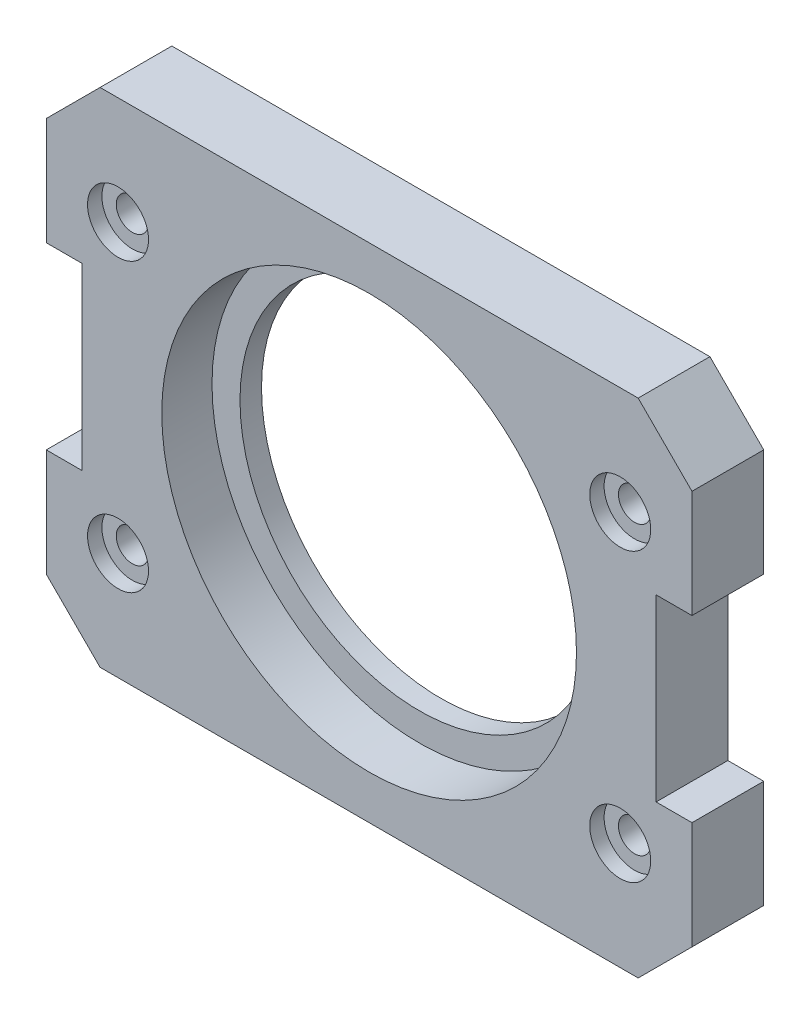
from build123d import *

# Parameters (mm, degrees)
CROQUIS1_W              = 90
CROQUIS1_H              = 70
CROQUIS1_R              = 28.9
CROQUIS1_R_2            = 2.25
SALIENTE_EXTRUIR1_DEPTH = 5
CROQUIS2_R              = 28.9
CROQUIS2_R_2            = 25
SALIENTE_EXTRUIR2_DEPTH = 3
CROQUIS3_R              = 4.25
CORTAR_EXTRUIR1_DEPTH   = 2
CROQUIS4_W              = 10
CROQUIS4_H              = 25
CORTAR_EXTRUIR2_DEPTH   = 58.879184514
CHAFL_N2_SIZE           = 7.5


with BuildPart() as part:
    # Croquis1 → Saliente-Extruir1 (new, symmetric)
    with BuildSketch(Plane.XY):
        Rectangle(CROQUIS1_W, CROQUIS1_H)
        Circle(CROQUIS1_R, mode=Mode.SUBTRACT)
        with Locations((35, 20)):
            Circle(CROQUIS1_R_2, mode=Mode.SUBTRACT)
        with Locations((35, -20)):
            Circle(CROQUIS1_R_2, mode=Mode.SUBTRACT)
        with Locations((-35, -20)):
            Circle(CROQUIS1_R_2, mode=Mode.SUBTRACT)
        with Locations((-35, 20)):
            Circle(CROQUIS1_R_2, mode=Mode.SUBTRACT)
    extrude(amount=SALIENTE_EXTRUIR1_DEPTH, both=True)

    # Croquis2 → Saliente-Extruir2 (add)
    with BuildSketch(Plane(origin=(0, 0, -5), x_dir=(-1, 0, 0), z_dir=(0, 0, -1))):
        Circle(CROQUIS2_R)
        Circle(CROQUIS2_R_2, mode=Mode.SUBTRACT)
    extrude(amount=-SALIENTE_EXTRUIR2_DEPTH)

    # Croquis3 → Cortar-Extruir1 (cut)
    with BuildSketch(Plane.XY.offset(5)):
        with Locations((-35, 20)):
            Circle(CROQUIS3_R)
        with Locations((35, 20)):
            Circle(CROQUIS3_R)
        with Locations((35, -20)):
            Circle(CROQUIS3_R)
        with Locations((-35, -20)):
            Circle(CROQUIS3_R)
    extrude(amount=-CORTAR_EXTRUIR1_DEPTH, mode=Mode.SUBTRACT)

    # Croquis4 → Cortar-Extruir2 (cut, through all)
    with BuildSketch(Plane.XY.offset(5)):
        with Locations((-45, 0)):
            Rectangle(CROQUIS4_W, CROQUIS4_H)
        with Locations((45, 0)):
            Rectangle(CROQUIS4_W, CROQUIS4_H)
    extrude(amount=-CORTAR_EXTRUIR2_DEPTH, mode=Mode.SUBTRACT)

    # Chaflán2
    chafl_n2_edges = [part.edges().sort_by_distance(p)[0] for p in [
        (45, -35, 0),
        (-45, -35, 0),
        (-45, 35, 0),
        (45, 35, 0),
    ]]
    chamfer(chafl_n2_edges, length=CHAFL_N2_SIZE)


solid = part.part
